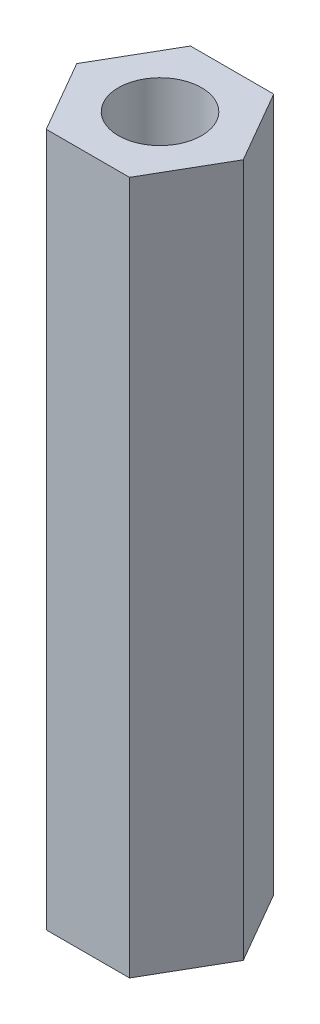
from build123d import *

# Parameters (mm, degrees)
SKETCH1_R           = 1.5
BOSS_EXTRUDE1_DEPTH = 25


with BuildPart() as part:
    # Sketch1 → Boss-Extrude1 (new body)
    with BuildSketch(Plane(origin=(0, 0, 0), x_dir=(1, 0, 0), z_dir=(0, 1, 0))):
        Polygon((3.0022214, 0), (1.5011107, 2.6), (-1.5011107, 2.6), (-3.0022214, 0), (-1.5011107, -2.6), (1.5011107, -2.6), align=None)
        with Locations(Location((0, 0, 0), (0, 0, 270))):
            Circle(SKETCH1_R, mode=Mode.SUBTRACT)
    extrude(amount=BOSS_EXTRUDE1_DEPTH)


solid = part.part
